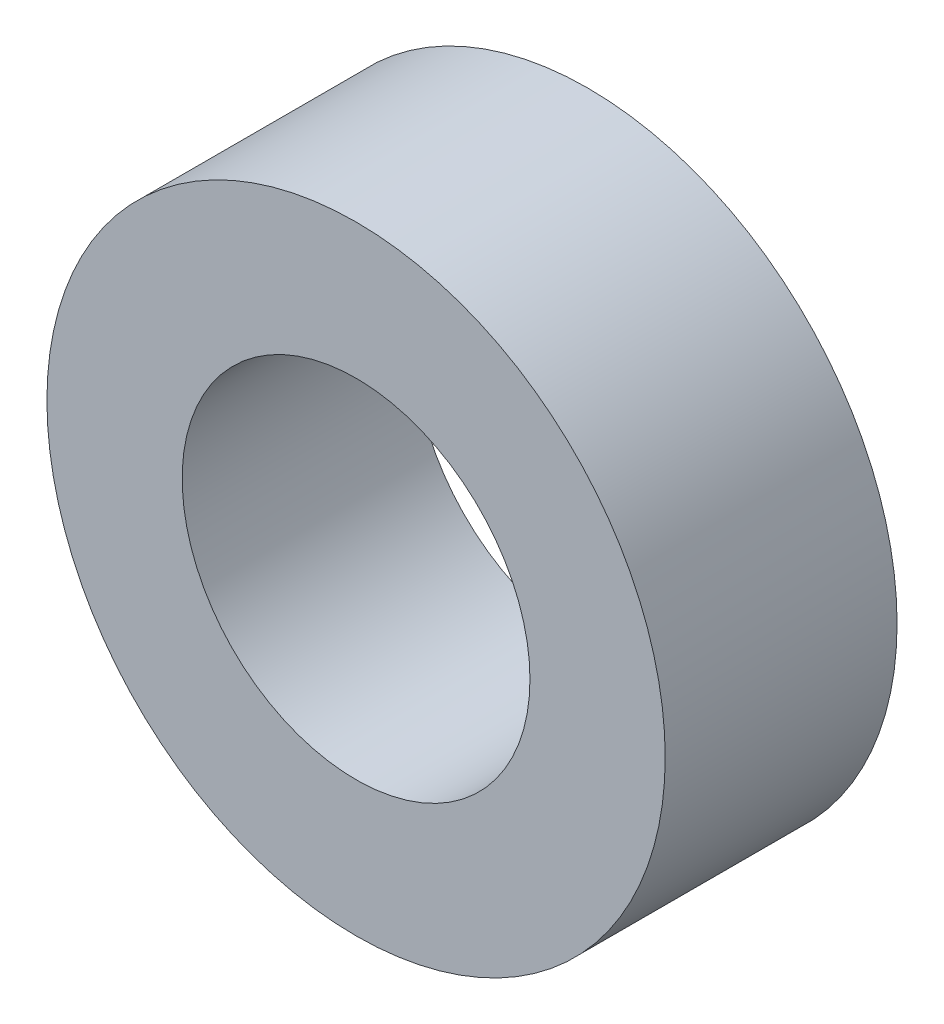
from build123d import *

# Parameters (mm, degrees)
ESBO_O1_R                = 4
ESBO_O1_R_2              = 2.25
RESSALTO_EXTRUS_O1_DEPTH = 3


with BuildPart() as part:
    # Esboço1 → Ressalto-extrusão1 (new body)
    with BuildSketch(Plane.XY):
        Circle(ESBO_O1_R)
        Circle(ESBO_O1_R_2, mode=Mode.SUBTRACT)
    extrude(amount=RESSALTO_EXTRUS_O1_DEPTH)


solid = part.part
